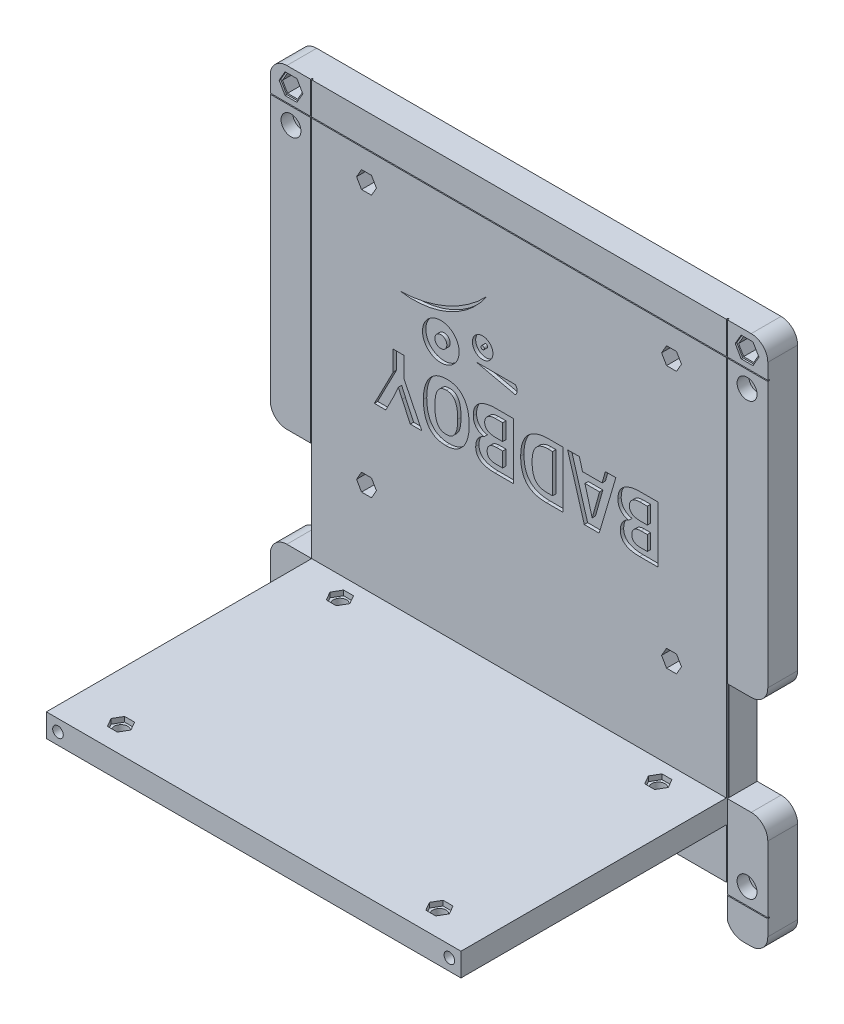
from build123d import *

# Parameters (mm, degrees)
SKETCH_1_W           = 150
SKETCH_1_H           = 160
EXTRUDE_5_DEPTH      = 9
SKETCH_12_W          = 0.3
SKETCH_12_H          = 160
CUT_EXTRUDE_8_DEPTH  = 0.5
SKETCH_13_W          = 0.298773589
SKETCH_13_H          = 160
CUT_EXTRUDE_9_DEPTH  = 0.5
CUT_EXTRUDE_22_DEPTH = 0.5
CUT_EXTRUDE_23_DEPTH = 4
SKETCH_26_W          = 150
SKETCH_26_H          = 0.3
CUT_EXTRUDE_27_DEPTH = 0.5
SKETCH_27_W          = 150
SKETCH_27_H          = 0.3
CUT_EXTRUDE_28_DEPTH = 0.5
CUT_EXTRUDE_30_DEPTH = 0.5
CUT_EXTRUDE_31_DEPTH = 4
SKETCH_38_W          = 125
SKETCH_38_H          = 7
EXTRUDE_6_DEPTH      = 80
SKETCH_41_R          = 3
EXTRUDE_8_DEPTH      = 3
SKETCH_42_R          = 2
CUT_EXTRUDE_37_DEPTH = 12
CUT_EXTRUDE_39_DEPTH = 0.5
CUT_EXTRUDE_40_DEPTH = 1.5
SKETCH_46_R          = 1.6
CUT_EXTRUDE_41_DEPTH = 5.5
SKETCH_53_R          = 1.6
CUT_EXTRUDE_45_DEPTH = 7
SKETCH_54_W          = 125
SKETCH_54_H          = 13
CUT_EXTRUDE_46_DEPTH = 10
SKETCH_56_R          = 3.5
EXTRUDE_11_DEPTH     = 5
CUT_EXTRUDE_47_DEPTH = 12.5
SKETCH_59_R          = 1.6
CUT_EXTRUDE_48_DEPTH = 15
SKETCH_62_R          = 3
CUT_EXTRUDE_50_DEPTH = 3.5
SKETCH_63_R          = 3
CUT_EXTRUDE_51_DEPTH = 2.2
CUT_EXTRUDE_52_DEPTH = 1.5
SKETCH_65_R          = 1.6
CUT_EXTRUDE_53_DEPTH = 4.5
SKETCH_66_R          = 2.5
CUT_EXTRUDE_54_DEPTH = 2.2
FILLET_1_R           = 5
SKETCH_67_W          = 12.2
SKETCH_67_H          = 30
SKETCH_67_W_2        = 12.201226411
CUT_EXTRUDE_55_DEPTH = 12
FILLET_4_R           = 5
SKETCH_68_R          = 3.095640607
SKETCH_68_R_2        = 0.512366482
SKETCH_68_R_3        = 5.52330776
SKETCH_68_R_4        = 1.815611901
CUT_EXTRUDE_56_DEPTH = 1


with BuildPart() as part:
    # 草圖1 → 填料-伸長5 (new body)
    with BuildSketch(Plane.XY):
        with Locations((-7.03125, 7.5)):
            Rectangle(SKETCH_1_W, SKETCH_1_H)
    extrude(amount=EXTRUDE_5_DEPTH)

    # 草圖12 → 除料-伸長8 (cut)
    with BuildSketch(Plane.XY.offset(9)):
        with Locations((-69.68125, 7.5)):
            Rectangle(SKETCH_12_W, SKETCH_12_H)
    extrude(amount=-CUT_EXTRUDE_8_DEPTH, mode=Mode.SUBTRACT)

    # 草圖13 → 除料-伸長9 (cut)
    with BuildSketch(Plane.XY.offset(9)):
        with Locations((55.618136795, 7.5)):
            Rectangle(SKETCH_13_W, SKETCH_13_H)
    extrude(amount=-CUT_EXTRUDE_9_DEPTH, mode=Mode.SUBTRACT)

    # 草圖19 → 除料-伸長22 (cut)
    with BuildSketch(Plane.XY.offset(9)):
        Polygon((-72.20125, 82.5), (-73.99125, 85.600370946), (-77.57125, 85.600370946), (-79.36125, 82.5), (-77.57125, 79.399629054), (-73.99125, 79.399629054), align=None)
    extrude(amount=-CUT_EXTRUDE_22_DEPTH, mode=Mode.SUBTRACT)

    # 草圖22 → 除料-伸長23 (cut)
    with BuildSketch(Plane.XY.offset(8.5)):
        Polygon((-72.73125, 82.5), (-74.25625, 85.141377482), (-77.30625, 85.141377482), (-78.83125, 82.5), (-77.30625, 79.858622518), (-74.25625, 79.858622518), align=None)
    extrude(amount=-CUT_EXTRUDE_23_DEPTH, mode=Mode.SUBTRACT)

    # 草圖26 → 除料-伸長27 (cut)
    with BuildSketch(Plane.XY.offset(9)):
        with Locations((-7.03125, 77.65)):
            Rectangle(SKETCH_26_W, SKETCH_26_H)
    extrude(amount=-CUT_EXTRUDE_27_DEPTH, mode=Mode.SUBTRACT)

    # 草圖27 → 除料-伸長28 (cut)
    with BuildSketch(Plane.XY.offset(9)):
        with Locations((-7.03125, -62.65)):
            Rectangle(SKETCH_27_W, SKETCH_27_H)
    extrude(amount=-CUT_EXTRUDE_28_DEPTH, mode=Mode.SUBTRACT)

    # 草圖32 → 除料-伸長30 (cut)
    with BuildSketch(Plane.XY.offset(9)):
        Polygon((65.29875, 82.5), (63.50875, 85.600370946), (59.92875, 85.600370946), (58.13875, 82.5), (59.92875, 79.399629054), (63.50875, 79.399629054), align=None)
    extrude(amount=-CUT_EXTRUDE_30_DEPTH, mode=Mode.SUBTRACT)

    # 草圖33 → 除料-伸長31 (cut)
    with BuildSketch(Plane.XY.offset(8.5)):
        Polygon((64.76875, 82.5), (63.24375, 85.141377482), (60.19375, 85.141377482), (58.66875, 82.5), (60.19375, 79.858622518), (63.24375, 79.858622518), align=None)
    extrude(amount=-CUT_EXTRUDE_31_DEPTH, mode=Mode.SUBTRACT)

    # 草圖38 → 填料-伸長6 (add)
    with BuildSketch(Plane.XY.offset(9)):
        with Locations((-7.03125, -41)):
            Rectangle(SKETCH_38_W, SKETCH_38_H)
    extrude(amount=EXTRUDE_6_DEPTH)

    # 草圖41 → 填料-伸長8 (add)
    with BuildSketch(Plane.XZ.offset(44.5)):
        with Locations(Location((-55.03125, 81, 0), (0, 0, 90))):
            Circle(SKETCH_41_R)
        with Locations(Location((40.96875, 81, 0), (0, 0, 90))):
            Circle(SKETCH_41_R)
        with Locations(Location((-55.03125, 15, 0), (0, 0, 90))):
            Circle(SKETCH_41_R)
        with Locations(Location((40.96875, 15, 0), (0, 0, 90))):
            Circle(SKETCH_41_R)
    extrude(amount=EXTRUDE_8_DEPTH)

    # 草圖42 → 除料-伸長37 (cut)
    with BuildSketch(Plane.XZ.offset(47.5)):
        with Locations(Location((-55.03125, 81, 0), (0, 0, 270))):
            Circle(SKETCH_42_R)
        with Locations(Location((40.96875, 81, 0), (0, 0, 270))):
            Circle(SKETCH_42_R)
        with Locations(Location((-55.03125, 15, 0), (0, 0, 270))):
            Circle(SKETCH_42_R)
        with Locations(Location((40.96875, 15, 0), (0, 0, 270))):
            Circle(SKETCH_42_R)
    extrude(amount=-CUT_EXTRUDE_37_DEPTH, mode=Mode.SUBTRACT)

    # 草圖44 → 除料-伸長39 (cut)
    with BuildSketch(Plane(origin=(0, 0, 0), x_dir=(-1, 0, 0), z_dir=(0, 0, -1))):
        Polygon((-58.13875, 72.5), (-59.92875, 75.600370946), (-63.50875, 75.600370946), (-65.29875, 72.5), (-63.50875, 69.399629054), (-59.92875, 69.399629054), align=None)
        Polygon((79.36125, 72.5), (77.57125, 75.600370946), (73.99125, 75.600370946), (72.20125, 72.5), (73.99125, 69.399629054), (77.57125, 69.399629054), align=None)
        Polygon((79.36125, -57.5), (77.57125, -54.399629054), (73.99125, -54.399629054), (72.20125, -57.5), (73.99125, -60.600370946), (77.57125, -60.600370946), align=None)
        Polygon((-58.13875, -57.5), (-59.92875, -54.399629054), (-63.50875, -54.399629054), (-65.29875, -57.5), (-63.50875, -60.600370946), (-59.92875, -60.600370946), align=None)
    extrude(amount=-CUT_EXTRUDE_39_DEPTH, mode=Mode.SUBTRACT)

    # 草圖45 → 除料-伸長40 (cut)
    with BuildSketch(Plane(origin=(0, 0, 0.5), x_dir=(-1, 0, 0), z_dir=(0, 0, -1))):
        Polygon((-58.71875, 72.5), (-60.21875, 75.098076211), (-63.21875, 75.098076211), (-64.71875, 72.5), (-63.21875, 69.901923789), (-60.21875, 69.901923789), align=None)
        Polygon((78.78125, 72.5), (77.28125, 75.098076211), (74.28125, 75.098076211), (72.78125, 72.5), (74.28125, 69.901923789), (77.28125, 69.901923789), align=None)
        Polygon((78.78125, -57.5), (77.28125, -54.901923789), (74.28125, -54.901923789), (72.78125, -57.5), (74.28125, -60.098076211), (77.28125, -60.098076211), align=None)
        Polygon((-58.71875, -57.5), (-60.21875, -54.901923789), (-63.21875, -54.901923789), (-64.71875, -57.5), (-63.21875, -60.098076211), (-60.21875, -60.098076211), align=None)
    extrude(amount=-CUT_EXTRUDE_40_DEPTH, mode=Mode.SUBTRACT)

    # 草圖46 → 除料-伸長41 (cut)
    with BuildSketch(Plane(origin=(0, 0, 2), x_dir=(-1, 0, 0), z_dir=(0, 0, -1))):
        with Locations((-61.71875, 72.5)):
            Circle(SKETCH_46_R)
        with Locations((75.78125, 72.5)):
            Circle(SKETCH_46_R)
        with Locations((75.78125, -57.5)):
            Circle(SKETCH_46_R)
        with Locations((-61.71875, -57.5)):
            Circle(SKETCH_46_R)
    extrude(amount=-CUT_EXTRUDE_41_DEPTH, mode=Mode.SUBTRACT)

    # 草圖53 → 除料-伸長45 (cut)
    with BuildSketch(Plane.XY.offset(89)):
        with Locations((-66.03125, -41)):
            Circle(SKETCH_53_R)
        with Locations((51.96875, -41)):
            Circle(SKETCH_53_R)
    extrude(amount=-CUT_EXTRUDE_45_DEPTH, mode=Mode.SUBTRACT)

    # 草圖54 → 除料-伸長46 (cut)
    with BuildSketch(Plane.XY.offset(9)):
        with Locations((-7.03125, -66)):
            Rectangle(SKETCH_54_W, SKETCH_54_H)
    extrude(amount=-CUT_EXTRUDE_46_DEPTH, mode=Mode.SUBTRACT)

    # 草圖56 → 填料-伸長11 (add)
    with BuildSketch(Plane(origin=(0, 0, 0), x_dir=(-1, 0, 0), z_dir=(0, 0, -1))):
        with Locations((-38.94875, 68.98)):
            Circle(SKETCH_56_R)
        with Locations((53.01125, 68.98)):
            Circle(SKETCH_56_R)
        with Locations((53.01125, -10.02)):
            Circle(SKETCH_56_R)
        with Locations((-38.94875, -10.02)):
            Circle(SKETCH_56_R)
    extrude(amount=EXTRUDE_11_DEPTH)

    # 草圖58 → 除料-伸長47 (cut)
    with BuildSketch(Plane.XY.offset(11)):
        Polygon((41.94875, -10.02), (40.44875, -7.421923789), (37.44875, -7.421923789), (35.94875, -10.02), (37.44875, -12.618076211), (40.44875, -12.618076211), align=None)
        Polygon((-50.01125, -10.02), (-51.51125, -7.421923789), (-54.51125, -7.421923789), (-56.01125, -10.02), (-54.51125, -12.618076211), (-51.51125, -12.618076211), align=None)
        Polygon((-50.01125, 68.98), (-51.51125, 71.578076211), (-54.51125, 71.578076211), (-56.01125, 68.98), (-54.51125, 66.381923789), (-51.51125, 66.381923789), align=None)
        Polygon((41.94875, 68.98), (40.44875, 71.578076211), (37.44875, 71.578076211), (35.94875, 68.98), (37.44875, 66.381923789), (40.44875, 66.381923789), align=None)
    extrude(amount=-CUT_EXTRUDE_47_DEPTH, mode=Mode.SUBTRACT)

    # 草圖59 → 除料-伸長48 (cut)
    with BuildSketch(Plane.XY.offset(11)):
        with Locations((-53.01125, -10.02)):
            Circle(SKETCH_59_R)
        with Locations((38.94875, -10.02)):
            Circle(SKETCH_59_R)
        with Locations((38.94875, 68.98)):
            Circle(SKETCH_59_R)
        with Locations((-53.01125, 68.98)):
            Circle(SKETCH_59_R)
    extrude(amount=-CUT_EXTRUDE_48_DEPTH, mode=Mode.SUBTRACT)

    # 草圖62 → 除料-伸長50 (cut)
    with BuildSketch(Plane.XY.offset(9)):
        with Locations((61.71875, 72.5)):
            Circle(SKETCH_62_R)
        with Locations((61.71875, -57.5)):
            Circle(SKETCH_62_R)
        with Locations((-75.78125, -57.5)):
            Circle(SKETCH_62_R)
        with Locations((-75.78125, 72.5)):
            Circle(SKETCH_62_R)
    extrude(amount=-CUT_EXTRUDE_50_DEPTH, mode=Mode.SUBTRACT)

    # 草圖63 → 除料-伸長51 (cut)
    with BuildSketch(Plane(origin=(0, 0, -5), x_dir=(-1, 0, 0), z_dir=(0, 0, -1))):
        with Locations((-38.94875, 68.98)):
            Circle(SKETCH_63_R)
        with Locations((53.01125, 68.98)):
            Circle(SKETCH_63_R)
        with Locations((53.01125, -10.02)):
            Circle(SKETCH_63_R)
        with Locations((-38.94875, -10.02)):
            Circle(SKETCH_63_R)
    extrude(amount=-CUT_EXTRUDE_51_DEPTH, mode=Mode.SUBTRACT)

    # 草圖64 → 除料-伸長52 (cut)
    with BuildSketch(Plane(origin=(0, -37.5, 0), x_dir=(1, 0, 0), z_dir=(0, 1, 0))):
        Polygon((-52.0290286, -15), (-53.5301393, -12.4), (-56.5323607, -12.4), (-58.0334714, -15), (-56.5323607, -17.6), (-53.5301393, -17.6), align=None)
        Polygon((43.9709714, -15), (42.4698607, -12.4), (39.4676393, -12.4), (37.9665286, -15), (39.4676393, -17.6), (42.4698607, -17.6), align=None)
        Polygon((43.9709714, -81), (42.4698607, -78.4), (39.4676393, -78.4), (37.9665286, -81), (39.4676393, -83.6), (42.4698607, -83.6), align=None)
        Polygon((-52.0290286, -81), (-53.5301393, -78.4), (-56.5323607, -78.4), (-58.0334714, -81), (-56.5323607, -83.6), (-53.5301393, -83.6), align=None)
    extrude(amount=-CUT_EXTRUDE_52_DEPTH, mode=Mode.SUBTRACT)

    # 草圖65 → 除料-伸長53 (cut)
    with BuildSketch(Plane.XY.offset(4.5)):
        with Locations((61.71875, 82.5)):
            Circle(SKETCH_65_R)
        with Locations((-75.78125, 82.5)):
            Circle(SKETCH_65_R)
    extrude(amount=-CUT_EXTRUDE_53_DEPTH, mode=Mode.SUBTRACT)

    # 草圖66 → 除料-伸長54 (cut)
    with BuildSketch(Plane(origin=(0, 0, 0), x_dir=(-1, 0, 0), z_dir=(0, 0, -1))):
        with Locations((-61.71875, 82.5)):
            Circle(SKETCH_66_R)
        with Locations((75.78125, 82.5)):
            Circle(SKETCH_66_R)
    extrude(amount=-CUT_EXTRUDE_54_DEPTH, mode=Mode.SUBTRACT)

    # 圓角1
    fillet_1_edges = [part.edges().sort_by_distance(p)[0] for p in [
        (-69.53125, -72.5, 4.25),
        (-82.03125, -72.5, 4.5),
        (55.46875, -72.5, 4.25),
        (67.96875, -72.5, 4.5),
        (67.96875, 87.5, 4.5),
        (-82.03125, 87.5, 4.5),
    ]]
    fillet(fillet_1_edges, radius=FILLET_1_R)

    # 草圖67 → 除料-伸長55 (cut)
    with BuildSketch(Plane.XY.offset(11)):
        with Locations((-75.93125, -22.5)):
            Rectangle(SKETCH_67_W, SKETCH_67_H)
        with Locations((61.868136795, -22.5)):
            Rectangle(SKETCH_67_W_2, SKETCH_67_H)
    extrude(amount=-CUT_EXTRUDE_55_DEPTH, mode=Mode.SUBTRACT)

    # 圓角4
    fillet_4_edges = [part.edges().sort_by_distance(p)[0] for p in [
        (-82.03125, -37.5, 4.5),
        (-82.03125, -7.5, 4.5),
        (67.96875, -7.5, 4.5),
        (67.96875, -37.5, 4.5),
    ]]
    fillet(fillet_4_edges, radius=FILLET_4_R)

    # 草圖68 → 除料-伸長56 (cut)
    # profile 1 of 10: a face of its own
    with BuildSketch(Plane.XY.offset(9)):
        with Locations((-18.004897387, 43.327804538)):
            Circle(SKETCH_68_R)
        with Locations((-18.004897387, 43.327804538)):
            Circle(SKETCH_68_R_2, mode=Mode.SUBTRACT)
    # profile 2 of 10: a face of its own
    with BuildSketch(Plane.XY.offset(9)):
        with Locations((-30.60448534, 38.630237208)):
            Circle(SKETCH_68_R_3)
        with Locations((-30.60448534, 38.630237208)):
            Circle(SKETCH_68_R_4, mode=Mode.SUBTRACT)
    # profile 3 of 10: a face of its own
    with BuildSketch(Plane.XY.offset(9)):
        with BuildLine():
            Line((-19.935249672, 38.630237208), (-8.142608601, 35.973987268))
            ThreePointArc((-8.142608601, 35.973987268), (-7.592481225, 37.302112238), (-8.142608601, 38.630237208))
            Line((-8.142608601, 38.630237208), (-19.935249672, 38.630237208))
        make_face()
    # profile 4 of 10: a face of its own
    with BuildSketch(Plane.XY.offset(9)):
        with BuildLine():
            ThreePointArc((-16.828348374, 57.224782038), (-28.185781805, 47.656824289), (-42.904394707, 45.682098012))
            ThreePointArc((-42.904394707, 45.682098012), (-28.721165868, 48.866308981), (-16.828348374, 57.224782038))
        make_face()
    # profile 5 of 10: a face of its own
    with BuildSketch(Plane.XY.offset(9)):
        Polygon((-44.973278986, 23.459166667), (-44.973278986, 29.48), (-41.770380435, 29.48), (-41.770380435, 23.482264493), (-36.35009058, 12.48), (-39.799365942, 12.48), (-42.274682971, 17.734755435), (-43.410326087, 20.310163043), (-44.561367754, 17.657762681), (-47.19067029, 12.48), (-50.639945652, 12.48), align=None)
    # profile 6 of 10: a face of its own
    with BuildSketch(Plane.XY.offset(9)):
        with BuildLine():
            add(Edge.make_bspline(
                [(-35.857336957, 20.903007246), (-35.850810853, 21.274085584), (-35.838207394, 21.990726155), (-35.738489932, 23.025625144), (-35.571547099, 23.981608573), (-35.333860108, 24.859301754), (-35.030494817, 25.657892976), (-34.686602345, 26.388053412), (-34.285654105, 27.041731604), (-33.833238962, 27.620399168), (-33.331878756, 28.122159122), (-32.796297551, 28.56267792), (-32.213203739, 28.926873101), (-31.591328009, 29.217898378), (-30.939617544, 29.445830975), (-30.263318553, 29.605004991), (-29.566549305, 29.711452386), (-29.093922751, 29.72136337), (-28.854846014, 29.726376812)],
                knots=[0, 0, 0, 0, 1.399147349, 2.702086469, 3.916134137, 5.054820572, 6.125245074, 7.133847534, 8.094080105, 9.010810961, 9.897034179, 10.763876246, 11.620473937, 12.481991629, 13.348185144, 14.219056267, 15.099114909, 16, 16, 16, 16], degree=3))
            add(Edge.make_bspline(
                [(-28.854846014, 29.726376812), (-28.58116434, 29.720183239), (-28.049676745, 29.708155372), (-27.278436483, 29.601971462), (-26.558902669, 29.430985415), (-25.89164302, 29.187891879), (-25.276128811, 28.874232587), (-24.716014567, 28.486591995), (-24.206418785, 28.031533316), (-23.750842148, 27.50860302), (-23.34880656, 26.918912874), (-23.002981488, 26.264669136), (-22.710119763, 25.548782281), (-22.474039421, 24.770932478), (-22.283181264, 23.932648598), (-22.158043228, 23.029732853), (-22.073956067, 22.064623224), (-22.064903469, 21.399805316), (-22.060235507, 21.056992754)],
                knots=[0, 0, 0, 0, 1.046307777, 2.031921225, 2.971120198, 3.870117085, 4.741522104, 5.605989075, 6.468014536, 7.348001511, 8.251901604, 9.191613366, 10.173198413, 11.20554282, 12.2973633, 13.457862975, 14.689150073, 16, 16, 16, 16], degree=3))
            add(Edge.make_bspline(
                [(-22.060235507, 21.056992754), (-22.066860428, 20.685929689), (-22.079654726, 19.969318614), (-22.178187502, 18.932729517), (-22.350113643, 17.976004288), (-22.588682567, 17.097816986), (-22.885147457, 16.298215385), (-23.232333183, 15.571293566), (-23.631732152, 14.918190637), (-24.084370303, 14.339599467), (-24.585721093, 13.837916313), (-25.121133972, 13.39702993), (-25.705369581, 13.033919822), (-26.325248203, 12.73756707), (-26.976391073, 12.510118948), (-27.653348232, 12.355223734), (-28.349733043, 12.24857498), (-28.82364332, 12.238636869), (-29.062726449, 12.233623188)],
                knots=[0, 0, 0, 0, 1.399094986, 2.701985343, 3.921606295, 5.060250114, 6.128937938, 7.133140352, 8.093336986, 9.010033534, 9.896223585, 10.76303321, 11.619598843, 12.483160966, 13.349322064, 14.214333538, 15.099148625, 16, 16, 16, 16], degree=3))
            add(Edge.make_bspline(
                [(-29.062726449, 12.233623188), (-29.336411538, 12.239809705), (-29.867905763, 12.251823871), (-30.63909924, 12.358104467), (-31.358798248, 12.528749122), (-32.024929628, 12.77284059), (-32.641386039, 13.081530219), (-33.201238319, 13.465790689), (-33.712312514, 13.91691831), (-34.166564785, 14.440027253), (-34.56880947, 15.029488341), (-34.914591234, 15.683793209), (-35.207401901, 16.399677447), (-35.444116999, 17.178667163), (-35.63427838, 18.01971), (-35.759546484, 18.926423189), (-35.843491275, 19.894106073), (-35.852632398, 20.560197509), (-35.857336957, 20.903007246)],
                knots=[0, 0, 0, 0, 1.045897962, 2.031125367, 2.969956478, 3.868601248, 4.737437825, 5.598790407, 6.457218041, 7.336860345, 8.240406401, 9.1797501, 10.160950682, 11.192890743, 12.289069571, 13.453969879, 14.689663503, 16, 16, 16, 16], degree=3))
        make_face()
        with BuildLine():
            add(Edge.make_bspline(
                [(-32.408061594, 21.056992754), (-32.406398508, 20.818249752), (-32.403177266, 20.355827081), (-32.362773036, 19.685552095), (-32.304150036, 19.062109426), (-32.215690991, 18.484892761), (-32.101308718, 17.955172374), (-31.964004777, 17.472245253), (-31.802023175, 17.036388943), (-31.615557823, 16.646509301), (-31.397773117, 16.301232603), (-31.146888038, 16.001313498), (-30.85963385, 15.750647441), (-30.543505862, 15.542008719), (-30.192556836, 15.383195384), (-29.808354375, 15.274081198), (-29.393905719, 15.202011661), (-29.106674047, 15.194178177), (-28.958786232, 15.190144928)],
                knots=[0, 0, 0, 0, 1.48586928, 2.877988626, 4.178260337, 5.382494365, 6.510515689, 7.549536365, 8.504970256, 9.401636694, 10.234791348, 11.039668792, 11.826387412, 12.599568055, 13.389523881, 14.213515518, 15.080187485, 16, 16, 16, 16], degree=3))
            add(Edge.make_bspline(
                [(-28.958786232, 15.190144928), (-28.810948956, 15.194321053), (-28.525081285, 15.202396277), (-28.111648284, 15.271961132), (-27.733950135, 15.391309831), (-27.386569478, 15.555094564), (-27.074172664, 15.76892286), (-26.790880761, 16.026654744), (-26.533781129, 16.325125014), (-26.31179271, 16.671708493), (-26.115342367, 17.058864129), (-25.946434758, 17.486688979), (-25.808401457, 17.957294326), (-25.697863886, 18.469510367), (-25.615576157, 19.022724193), (-25.554361511, 19.614852117), (-25.514631197, 20.24545963), (-25.511250029, 20.679666017), (-25.50951087, 20.903007246)],
                knots=[0, 0, 0, 0, 0.940630821, 1.818864292, 2.65845151, 3.454932939, 4.25467471, 5.058535564, 5.886922451, 6.75464693, 7.671571422, 8.646886958, 9.678066656, 10.789974457, 11.979856081, 13.236419238, 14.578506571, 16, 16, 16, 16], degree=3))
            add(Edge.make_bspline(
                [(-25.50951087, 20.903007246), (-25.511303509, 21.141738675), (-25.514775682, 21.604138932), (-25.553434844, 22.274700333), (-25.618081623, 22.897735567), (-25.706679655, 23.473286409), (-25.814610011, 24.003352156), (-25.958548136, 24.484970188), (-26.121916118, 24.921161898), (-26.311412124, 25.312021574), (-26.529099955, 25.657128633), (-26.783324639, 25.953861664), (-27.066867239, 26.20632253), (-27.380668661, 26.418505949), (-27.731791489, 26.575818325), (-28.112927973, 26.686118574), (-28.524933077, 26.758169244), (-28.810898436, 26.765871717), (-28.958786232, 26.769855072)],
                knots=[0, 0, 0, 0, 1.487309885, 2.880778942, 4.18312145, 5.388523027, 6.508143508, 7.550412565, 8.517077613, 9.407426851, 10.252430577, 11.051995533, 11.833487747, 12.611824392, 13.402546109, 14.219666898, 15.079295693, 16, 16, 16, 16], degree=3))
            add(Edge.make_bspline(
                [(-28.958786232, 26.769855072), (-29.106620071, 26.76560355), (-29.393746908, 26.75734613), (-29.808459976, 26.688345607), (-30.189550948, 26.568951624), (-30.535678111, 26.400736747), (-30.85237363, 26.191760652), (-31.134248146, 25.93305306), (-31.391280471, 25.634832323), (-31.614234278, 25.289298146), (-31.805033189, 24.899979938), (-31.9760869, 24.472432509), (-32.112328697, 23.999890048), (-32.22296293, 23.487876646), (-32.307452587, 22.936294784), (-32.361662066, 22.344860585), (-32.4033689, 21.714583807), (-32.406467684, 21.280348737), (-32.408061594, 21.056992754)],
                knots=[0, 0, 0, 0, 0.940064087, 1.825817626, 2.664898988, 3.471793211, 4.26649605, 5.069872574, 5.897760353, 6.764962024, 7.677654206, 8.65238211, 9.690767533, 10.802005404, 11.983101029, 13.238084309, 14.579363028, 16, 16, 16, 16], degree=3))
        make_face(mode=Mode.SUBTRACT)
    # profile 7 of 10: a face of its own
    with BuildSketch(Plane.XY.offset(9)):
        with BuildLine():
            Line((-8.755887681, 29.48), (-8.755887681, 12.48))
            Line((-8.755887681, 12.48), (-14.264719203, 12.48))
            add(Edge.make_bspline(
                [(-14.264719203, 12.48), (-14.499633583, 12.482756008), (-14.955825656, 12.488108038), (-15.616263402, 12.53488639), (-16.232712246, 12.609063423), (-16.801512891, 12.722560335), (-17.328722485, 12.856725682), (-17.80709824, 13.033414151), (-18.245671131, 13.228692159), (-18.633409296, 13.46773774), (-18.979062613, 13.731304091), (-19.275617965, 14.032936784), (-19.527760191, 14.364975915), (-19.7319343, 14.731323346), (-19.896740143, 15.12556574), (-20.005331115, 15.555083088), (-20.077258943, 16.014106248), (-20.085161411, 16.331911356), (-20.089221014, 16.495172101)],
                knots=[0, 0, 0, 0, 1.402141894, 2.722890013, 3.95045112, 5.105712154, 6.183372731, 7.193844671, 8.146694406, 9.04397864, 9.906621494, 10.7353702, 11.561139828, 12.387761716, 13.23274235, 14.104149408, 15.026076132, 16, 16, 16, 16], degree=3))
            add(Edge.make_bspline(
                [(-20.089221014, 16.495172101), (-20.081562556, 16.702250543), (-20.066370864, 17.113021412), (-19.952647365, 17.717079285), (-19.763627869, 18.289011324), (-19.489941444, 18.819180431), (-19.134082801, 19.294259855), (-18.77288166, 19.640556145), (-18.4463139, 19.879592659), (-18.179771747, 20.043228328), (-17.889809494, 20.181249642), (-17.686385848, 20.256539529), (-17.583106884, 20.294764493)],
                knots=[0, 0, 0, 0, 1.273282931, 2.525745962, 3.766312874, 4.966651541, 6.179075499, 7.401734087, 8.028500147, 8.666107305, 9.322777569, 10, 10, 10, 10], degree=3))
            add(Edge.make_bspline(
                [(-17.583106884, 20.294764493), (-17.796984275, 20.340269745), (-18.226753217, 20.431708789), (-18.732683459, 20.654152827), (-19.117944273, 20.86898002), (-19.382915821, 21.067462606), (-19.639067124, 21.275056494), (-19.869982894, 21.513422232), (-20.083639305, 21.769695843), (-20.267852804, 22.054781941), (-20.433126733, 22.358196702), (-20.577956616, 22.682454036), (-20.688499804, 23.029988871), (-20.769130165, 23.398473913), (-20.820805175, 23.786205037), (-20.825809878, 24.051845976), (-20.828351449, 24.186748188)],
                knots=[0, 0, 0, 0, 1.653732575, 3.323038944, 4.163945675, 4.992783381, 5.828441977, 6.660697115, 7.503851062, 8.35365534, 9.228529406, 10.12133363, 11.041072052, 11.987428034, 12.97794213, 14, 14, 14, 14], degree=3))
            add(Edge.make_bspline(
                [(-20.828351449, 24.186748188), (-20.823897034, 24.400084231), (-20.815218873, 24.815708799), (-20.727403199, 25.416257132), (-20.594132569, 25.978452586), (-20.403761205, 26.500044696), (-20.148541109, 26.97676517), (-19.848531775, 27.417551443), (-19.486440442, 27.811891755), (-19.070135214, 28.164337755), (-18.603075775, 28.475177956), (-18.087239191, 28.746605369), (-17.522149495, 28.970969411), (-16.911822908, 29.162298208), (-16.249922116, 29.30105204), (-15.540209438, 29.403654559), (-14.781889054, 29.471835801), (-14.259739616, 29.477228544), (-13.991394928, 29.48)],
                knots=[0, 0, 0, 0, 1.039524212, 2.025217098, 2.952402935, 3.853119196, 4.723533665, 5.58260844, 6.446227895, 7.325056685, 8.236079281, 9.176428647, 10.16166472, 11.196660215, 12.291302948, 13.454851804, 14.691989398, 16, 16, 16, 16], degree=3))
            Line((-13.991394928, 29.48), (-8.755887681, 29.48))
        make_face()
        with BuildLine():
            add(Edge.make_bspline(
                [(-16.639945652, 17.018722826), (-16.632462406, 16.868007411), (-16.617975853, 16.576242733), (-16.508662413, 16.158385508), (-16.301416127, 15.793472808), (-16.004541851, 15.482296269), (-15.602255661, 15.249398196), (-15.209254363, 15.103175966), (-14.848536316, 15.018179977), (-14.540001449, 14.980217559), (-14.206467953, 14.945126261), (-13.973542918, 14.944231769), (-13.852807971, 14.943768116)],
                knots=[0, 0, 0, 0, 1.142289256, 2.211317648, 3.239327812, 4.291942945, 5.431412139, 6.730486728, 7.459609351, 8.235510757, 9.085390225, 10, 10, 10, 10], degree=3))
            Line((-13.852807971, 14.943768116), (-11.958786232, 14.943768116))
            Line((-11.958786232, 14.943768116), (-11.958786232, 19.378550725))
            Line((-11.958786232, 19.378550725), (-13.852807971, 19.378550725))
            add(Edge.make_bspline(
                [(-13.852807971, 19.378550725), (-13.976071115, 19.376485013), (-14.211582817, 19.372538179), (-14.551868908, 19.338488604), (-14.860648211, 19.277143268), (-15.141804225, 19.196559476), (-15.39515102, 19.094597885), (-15.626502383, 18.977600263), (-15.831676301, 18.83696213), (-16.069768272, 18.635303434), (-16.316933147, 18.344013665), (-16.508682279, 17.93344233), (-16.61711525, 17.486307286), (-16.632209778, 17.177159576), (-16.639945652, 17.018722826)],
                knots=[0, 0, 0, 0, 1.069416557, 2.04327186, 2.962578429, 3.797652463, 4.577134421, 5.329092712, 6.042471673, 6.729649602, 8.034076942, 9.31892156, 10.625959893, 12, 12, 12, 12], degree=3))
        make_face(mode=Mode.SUBTRACT)
        with BuildLine():
            add(Edge.make_bspline(
                [(-14.226222826, 26.769855072), (-14.352087117, 26.76811065), (-14.596750027, 26.764719732), (-14.950642216, 26.725095498), (-15.281366796, 26.663413821), (-15.588693616, 26.580603279), (-15.871504982, 26.471485472), (-16.129108702, 26.345057639), (-16.365009379, 26.20105561), (-16.575210893, 26.03663808), (-16.76164747, 25.853893258), (-16.924464325, 25.656595881), (-17.063942972, 25.443512043), (-17.217216403, 25.140942266), (-17.352578741, 24.728698544), (-17.370168598, 24.384266241), (-17.379076087, 24.209846014)],
                knots=[0, 0, 0, 0, 1.157157867, 2.249356102, 3.270161525, 4.249388959, 5.172152313, 6.053611881, 6.885562673, 7.709522246, 8.502380967, 9.282130755, 10.057940578, 10.839118153, 12.399332112, 14, 14, 14, 14], degree=3))
            add(Edge.make_bspline(
                [(-17.379076087, 24.209846014), (-17.377595787, 24.119830045), (-17.374680977, 23.942582543), (-17.330006158, 23.685998109), (-17.264552783, 23.44486658), (-17.176391982, 23.216905166), (-17.05514393, 23.006860535), (-16.913831194, 22.807662711), (-16.739670792, 22.629919261), (-16.544488868, 22.463180755), (-16.318836177, 22.317037362), (-16.066101139, 22.188936611), (-15.784332429, 22.082572942), (-15.475226807, 21.994271307), (-15.139244581, 21.925973894), (-14.776795186, 21.875217816), (-14.385677913, 21.850555761), (-14.115892159, 21.845131538), (-13.975996377, 21.842318841)],
                knots=[0, 0, 0, 0, 0.919754586, 1.811058695, 2.654992043, 3.474055685, 4.302844904, 5.12996905, 5.965591625, 6.84129183, 7.751535517, 8.70847885, 9.734845764, 10.82757038, 11.993833379, 13.239544393, 14.568582333, 16, 16, 16, 16], degree=3))
            Line((-13.975996377, 21.842318841), (-11.958786232, 21.842318841))
            Line((-11.958786232, 21.842318841), (-11.958786232, 26.769855072))
            Line((-11.958786232, 26.769855072), (-14.226222826, 26.769855072))
        make_face(mode=Mode.SUBTRACT)
    # profile 8 of 10: a face of its own
    with BuildSketch(Plane.XY.offset(9)):
        with BuildLine():
            add(Edge.make_bspline(
                [(-6.538496377, 20.76442029), (-6.532984219, 21.086757154), (-6.522199715, 21.717407414), (-6.426050928, 22.64072843), (-6.279611633, 23.519112587), (-6.068156037, 24.350483178), (-5.794175968, 25.130276414), (-5.445384713, 25.851974717), (-5.028701282, 26.513689201), (-4.542592414, 27.115128913), (-3.991261019, 27.661125539), (-3.356242507, 28.127949247), (-2.658956939, 28.542613369), (-1.883229946, 28.878921511), (-1.032557575, 29.15037702), (-0.104018943, 29.343790277), (0.905030814, 29.459973784), (1.603161904, 29.473159324), (1.965353261, 29.48)],
                knots=[0, 0, 0, 0, 1.11048047, 2.172648783, 3.195503399, 4.17684417, 5.1251294, 6.038843485, 6.933188156, 7.813706323, 8.698643751, 9.598959211, 10.522676754, 11.488896983, 12.505577293, 13.594875197, 14.752217988, 16, 16, 16, 16], degree=3))
            Line((1.965353261, 29.48), (6.273097826, 29.48))
            Line((6.273097826, 29.48), (6.273097826, 12.48))
            Line((6.273097826, 12.48), (1.249320652, 12.48))
            add(Edge.make_bspline(
                [(1.249320652, 12.48), (0.934669348, 12.485385684), (0.324462153, 12.495830209), (-0.560615921, 12.591308386), (-1.385749404, 12.736980658), (-2.150936485, 12.949016654), (-2.855063797, 13.223920214), (-3.497093702, 13.571496366), (-4.082257717, 13.978155137), (-4.603357859, 14.458802692), (-5.064546033, 15.003290659), (-5.457736532, 15.621066362), (-5.79943132, 16.300378104), (-6.070959797, 17.054543982), (-6.281987147, 17.878364885), (-6.42804546, 18.775100178), (-6.522870475, 19.74480181), (-6.533163338, 20.416429829), (-6.538496377, 20.76442029)],
                knots=[0, 0, 0, 0, 1.153062163, 2.236147827, 3.259355608, 4.221454975, 5.142116454, 6.023963339, 6.891785768, 7.74738582, 8.615271988, 9.499899586, 10.425498651, 11.397243337, 12.432030406, 13.538639994, 14.724696141, 16, 16, 16, 16], degree=3))
        make_face()
        with BuildLine():
            add(Edge.make_bspline(
                [(-3.089221014, 20.972300725), (-3.0856591, 20.750264013), (-3.078715205, 20.317407046), (-3.042436915, 19.686287811), (-2.972737622, 19.092659694), (-2.877407633, 18.537035665), (-2.755114834, 18.018124954), (-2.582572804, 17.542702103), (-2.380611184, 17.104653253), (-2.13679962, 16.707814763), (-1.850872953, 16.354304188), (-1.518814046, 16.046248891), (-1.143082195, 15.783662968), (-0.721453108, 15.565482616), (-0.250167857, 15.396396442), (0.271492332, 15.274760481), (0.846848263, 15.200910366), (1.247803786, 15.193838289), (1.457201087, 15.190144928)],
                knots=[0, 0, 0, 0, 1.255575325, 2.447723734, 3.572711618, 4.633164565, 5.634480441, 6.582317664, 7.487917767, 8.357787713, 9.208813035, 10.050789434, 10.910309216, 11.793005851, 12.727192341, 13.733856717, 14.816516397, 16, 16, 16, 16], degree=3))
            Line((1.457201087, 15.190144928), (3.070199275, 15.190144928))
            Line((3.070199275, 15.190144928), (3.070199275, 26.769855072))
            Line((3.070199275, 26.769855072), (1.676630435, 26.769855072))
            add(Edge.make_bspline(
                [(1.676630435, 26.769855072), (1.487789287, 26.765430582), (1.120477219, 26.756824572), (0.587194493, 26.689934216), (0.087280457, 26.584572202), (-0.377097531, 26.429546385), (-0.807123552, 26.232527698), (-1.20403448, 25.994463339), (-1.559846275, 25.704173), (-1.886424067, 25.376901234), (-2.174835797, 24.998335117), (-2.419264923, 24.568492267), (-2.628484986, 24.091162477), (-2.795890159, 23.562843861), (-2.931282734, 22.986607467), (-3.019726661, 22.357777824), (-3.079405263, 21.681788089), (-3.085881451, 21.213686016), (-3.089221014, 20.972300725)],
                knots=[0, 0, 0, 0, 1.053857521, 2.049842366, 2.995403249, 3.901476054, 4.776493319, 5.631520769, 6.477256134, 7.333273182, 8.207204945, 9.125009066, 10.087244947, 11.111147308, 12.21447931, 13.387572439, 14.652854531, 16, 16, 16, 16], degree=3))
        make_face(mode=Mode.SUBTRACT)
    # profile 9 of 10: a face of its own
    with BuildSketch(Plane.XY.offset(9)):
        Polygon((11.162137681, 29.48), (12.105298913, 26.030724638), (18.022192029, 26.030724638), (18.996150362, 29.48), (22.164402174, 29.48), (17.121376812, 12.48), (12.651947464, 12.48), (7.62817029, 29.48), align=None)
        Polygon((15.019474638, 15.394175725), (17.252264493, 23.32057971), (12.844429348, 23.32057971), align=None, mode=Mode.SUBTRACT)
    # profile 10 of 10: a face of its own
    with BuildSketch(Plane.XY.offset(9)):
        with BuildLine():
            Line((34.852807971, 29.48), (34.852807971, 12.48))
            Line((34.852807971, 12.48), (29.343976449, 12.48))
            add(Edge.make_bspline(
                [(29.343976449, 12.48), (29.10906207, 12.482756008), (28.652869996, 12.488108038), (27.99243225, 12.53488639), (27.375983406, 12.609063423), (26.807182761, 12.722560335), (26.279973167, 12.856725682), (25.801597412, 13.033414151), (25.363024521, 13.228692159), (24.975286356, 13.46773774), (24.629633039, 13.731304091), (24.333077687, 14.032936784), (24.080935461, 14.364975915), (23.876761352, 14.731323346), (23.711955509, 15.12556574), (23.603364537, 15.555083088), (23.531436709, 16.014106248), (23.523534241, 16.331911356), (23.519474638, 16.495172101)],
                knots=[0, 0, 0, 0, 1.402141894, 2.722890013, 3.95045112, 5.105712154, 6.183372731, 7.193844671, 8.146694406, 9.04397864, 9.906621494, 10.7353702, 11.561139828, 12.387761716, 13.23274235, 14.104149408, 15.026076132, 16, 16, 16, 16], degree=3))
            add(Edge.make_bspline(
                [(23.519474638, 16.495172101), (23.527133096, 16.702250543), (23.542324788, 17.113021412), (23.656048287, 17.717079285), (23.845067783, 18.289011324), (24.118754208, 18.819180431), (24.474612851, 19.294259855), (24.835813992, 19.640556145), (25.162381752, 19.879592659), (25.428923905, 20.043228328), (25.718886158, 20.181249642), (25.922309804, 20.256539529), (26.025588768, 20.294764493)],
                knots=[0, 0, 0, 0, 1.273282931, 2.525745962, 3.766312874, 4.966651541, 6.179075499, 7.401734087, 8.028500147, 8.666107305, 9.322777569, 10, 10, 10, 10], degree=3))
            add(Edge.make_bspline(
                [(26.025588768, 20.294764493), (25.811711377, 20.340269745), (25.381942435, 20.431708789), (24.876012193, 20.654152827), (24.490751379, 20.86898002), (24.225779831, 21.067462606), (23.969628528, 21.275056494), (23.738712758, 21.513422232), (23.525056347, 21.769695843), (23.340842848, 22.054781941), (23.17556892, 22.358196702), (23.030739036, 22.682454036), (22.920195849, 23.029988871), (22.839565487, 23.398473913), (22.787890477, 23.786205037), (22.782885774, 24.051845976), (22.780344203, 24.186748188)],
                knots=[0, 0, 0, 0, 1.653732575, 3.323038944, 4.163945675, 4.992783381, 5.828441977, 6.660697115, 7.503851062, 8.35365534, 9.228529406, 10.12133363, 11.041072052, 11.987428034, 12.97794213, 14, 14, 14, 14], degree=3))
            add(Edge.make_bspline(
                [(22.780344203, 24.186748188), (22.784798618, 24.400084231), (22.793476779, 24.815708799), (22.881292453, 25.416257132), (23.014563083, 25.978452586), (23.204934447, 26.500044696), (23.460154543, 26.97676517), (23.760163877, 27.417551443), (24.122255211, 27.811891755), (24.538560438, 28.164337755), (25.005619877, 28.475177956), (25.521456462, 28.746605369), (26.086546158, 28.970969411), (26.696872744, 29.162298208), (27.358773536, 29.30105204), (28.068486214, 29.403654559), (28.826806598, 29.471835801), (29.348956036, 29.477228544), (29.617300725, 29.48)],
                knots=[0, 0, 0, 0, 1.039524212, 2.025217098, 2.952402935, 3.853119196, 4.723533665, 5.58260844, 6.446227895, 7.325056685, 8.236079281, 9.176428647, 10.16166472, 11.196660215, 12.291302948, 13.454851804, 14.691989398, 16, 16, 16, 16], degree=3))
            Line((29.617300725, 29.48), (34.852807971, 29.48))
        make_face()
        with BuildLine():
            add(Edge.make_bspline(
                [(26.96875, 17.018722826), (26.976233246, 16.868007411), (26.990719799, 16.576242733), (27.100033239, 16.158385508), (27.307279525, 15.793472808), (27.604153802, 15.482296269), (28.006439991, 15.249398196), (28.399441289, 15.103175966), (28.760159336, 15.018179977), (29.068694203, 14.980217559), (29.402227699, 14.945126261), (29.635152735, 14.944231769), (29.755887681, 14.943768116)],
                knots=[0, 0, 0, 0, 1.142289256, 2.211317648, 3.239327812, 4.291942945, 5.431412139, 6.730486728, 7.459609351, 8.235510757, 9.085390225, 10, 10, 10, 10], degree=3))
            Line((29.755887681, 14.943768116), (31.64990942, 14.943768116))
            Line((31.64990942, 14.943768116), (31.64990942, 19.378550725))
            Line((31.64990942, 19.378550725), (29.755887681, 19.378550725))
            add(Edge.make_bspline(
                [(29.755887681, 19.378550725), (29.632624537, 19.376485013), (29.397112835, 19.372538179), (29.056826744, 19.338488604), (28.748047441, 19.277143268), (28.466891428, 19.196559476), (28.213544632, 19.094597885), (27.982193269, 18.977600263), (27.777019351, 18.83696213), (27.53892738, 18.635303434), (27.291762505, 18.344013665), (27.100013373, 17.93344233), (26.991580402, 17.486307286), (26.976485874, 17.177159576), (26.96875, 17.018722826)],
                knots=[0, 0, 0, 0, 1.069416557, 2.04327186, 2.962578429, 3.797652463, 4.577134421, 5.329092712, 6.042471673, 6.729649602, 8.034076942, 9.31892156, 10.625959893, 12, 12, 12, 12], degree=3))
        make_face(mode=Mode.SUBTRACT)
        with BuildLine():
            add(Edge.make_bspline(
                [(29.382472826, 26.769855072), (29.256608535, 26.76811065), (29.011945625, 26.764719732), (28.658053436, 26.725095498), (28.327328856, 26.663413821), (28.020002036, 26.580603279), (27.73719067, 26.471485472), (27.47958695, 26.345057639), (27.243686273, 26.20105561), (27.033484759, 26.03663808), (26.847048182, 25.853893258), (26.684231327, 25.656595881), (26.544752681, 25.443512043), (26.391479249, 25.140942266), (26.256116912, 24.728698544), (26.238527054, 24.384266241), (26.229619565, 24.209846014)],
                knots=[0, 0, 0, 0, 1.157157867, 2.249356102, 3.270161525, 4.249388959, 5.172152313, 6.053611881, 6.885562673, 7.709522246, 8.502380967, 9.282130755, 10.057940578, 10.839118153, 12.399332112, 14, 14, 14, 14], degree=3))
            add(Edge.make_bspline(
                [(26.229619565, 24.209846014), (26.231099865, 24.119830045), (26.234014675, 23.942582543), (26.278689495, 23.685998109), (26.344142869, 23.44486658), (26.43230367, 23.216905166), (26.553551722, 23.006860535), (26.694864458, 22.807662711), (26.86902486, 22.629919261), (27.064206784, 22.463180755), (27.289859475, 22.317037362), (27.542594513, 22.188936611), (27.824363223, 22.082572942), (28.133468845, 21.994271307), (28.469451071, 21.925973894), (28.831900466, 21.875217816), (29.223017739, 21.850555761), (29.492803494, 21.845131538), (29.632699275, 21.842318841)],
                knots=[0, 0, 0, 0, 0.919754586, 1.811058695, 2.654992043, 3.474055685, 4.302844904, 5.12996905, 5.965591625, 6.84129183, 7.751535517, 8.70847885, 9.734845764, 10.82757038, 11.993833379, 13.239544393, 14.568582333, 16, 16, 16, 16], degree=3))
            Line((29.632699275, 21.842318841), (31.64990942, 21.842318841))
            Line((31.64990942, 21.842318841), (31.64990942, 26.769855072))
            Line((31.64990942, 26.769855072), (29.382472826, 26.769855072))
        make_face(mode=Mode.SUBTRACT)
    extrude(amount=-CUT_EXTRUDE_56_DEPTH, mode=Mode.SUBTRACT)


solid = part.part
